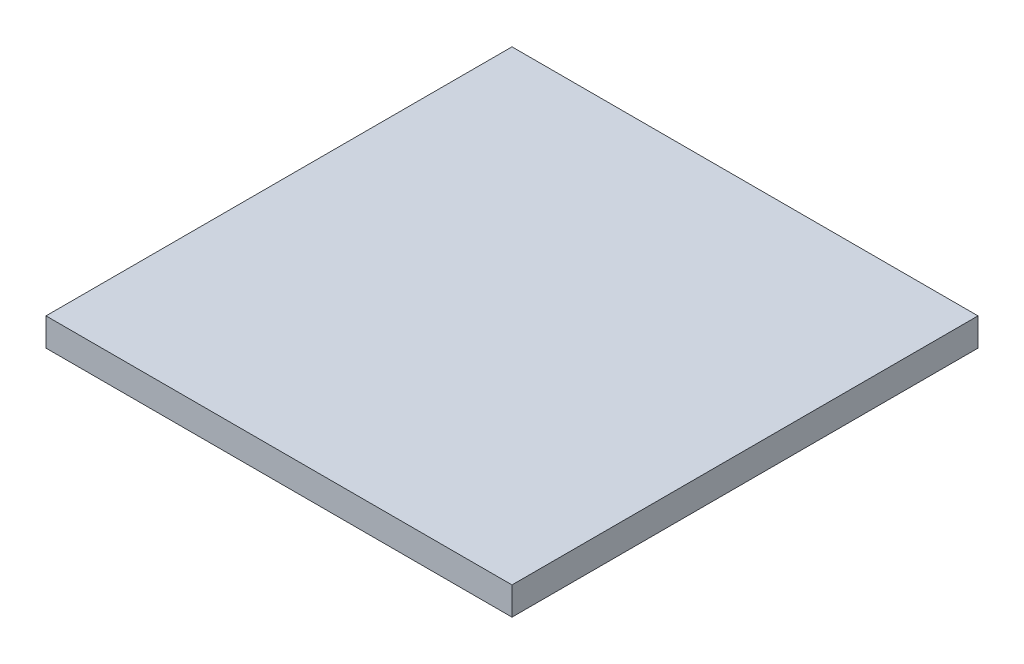
from build123d import *

# Parameters (mm, degrees)
SKETCH1_W           = 100
SKETCH1_H           = 100
BOSS_EXTRUDE1_DEPTH = 6


with BuildPart() as part:
    # Sketch1 → Boss-Extrude1 (new body)
    with BuildSketch(Plane(origin=(0, 0, 0), x_dir=(1, 0, 0), z_dir=(0, 1, 0))):
        Rectangle(SKETCH1_W, SKETCH1_H)
    extrude(amount=BOSS_EXTRUDE1_DEPTH)


solid = part.part
